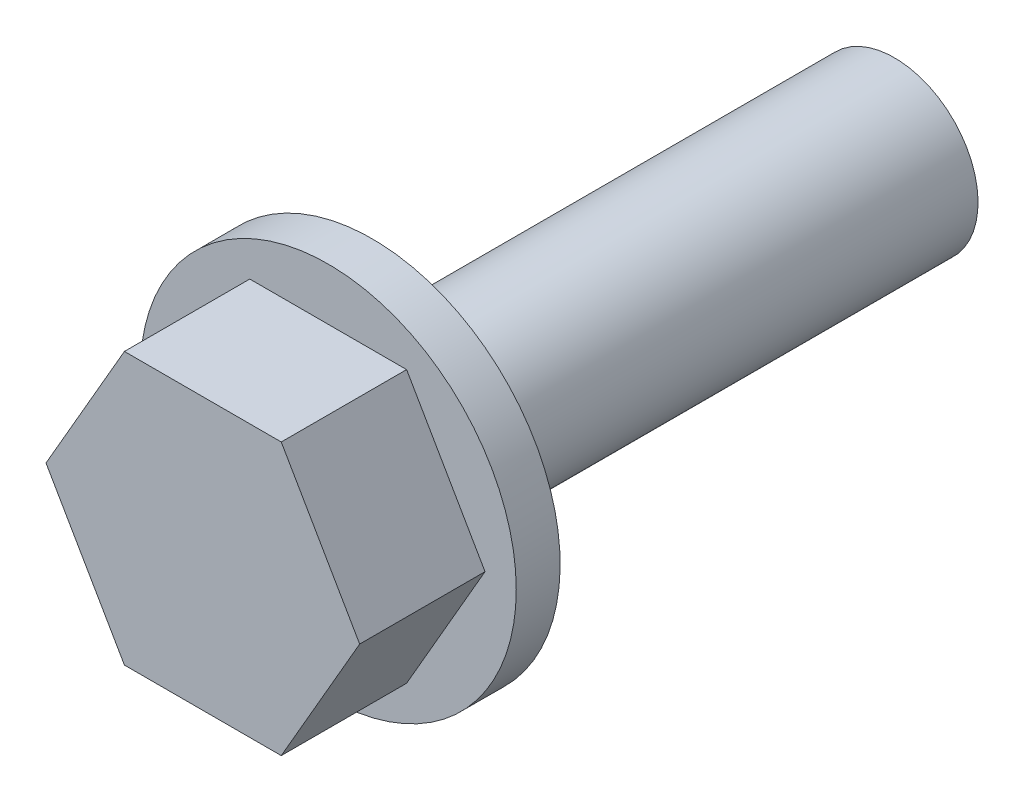
from build123d import *

# Parameters (mm, degrees)
SKETCH2_OUTSIDE_W  = 28.352
SKETCH2_OUTSIDE_H  = 28.352
CUT_EXTRUDE1_DEPTH = 6


with BuildPart() as part:
    # Sketch1 → Revolve1 (revolve)
    with BuildSketch(Plane(origin=(0, 0, 0), x_dir=(0, 0, -1), z_dir=(1, 0, 0))):
        Polygon((-8.1, 0), (-8.1, 9), (0, 9), (0, 4), (25, 4), (25, 0), align=None)
    revolve(axis=Axis((0, 0, 5.584882278), (0, 0, -1)))

    # Sketch2 outside → Cut-Extrude1 (cut)
    with BuildSketch(Plane.XY.offset(8.1)):
        Rectangle(SKETCH2_OUTSIDE_W, SKETCH2_OUTSIDE_H)
        Polygon((3.75277675, -6.5), (7.505553499, 0), (3.75277675, 6.5), (-3.75277675, 6.5), (-7.505553499, 0), (-3.75277675, -6.5), align=None, mode=Mode.SUBTRACT)
    extrude(amount=-CUT_EXTRUDE1_DEPTH, mode=Mode.SUBTRACT)


solid = part.part
